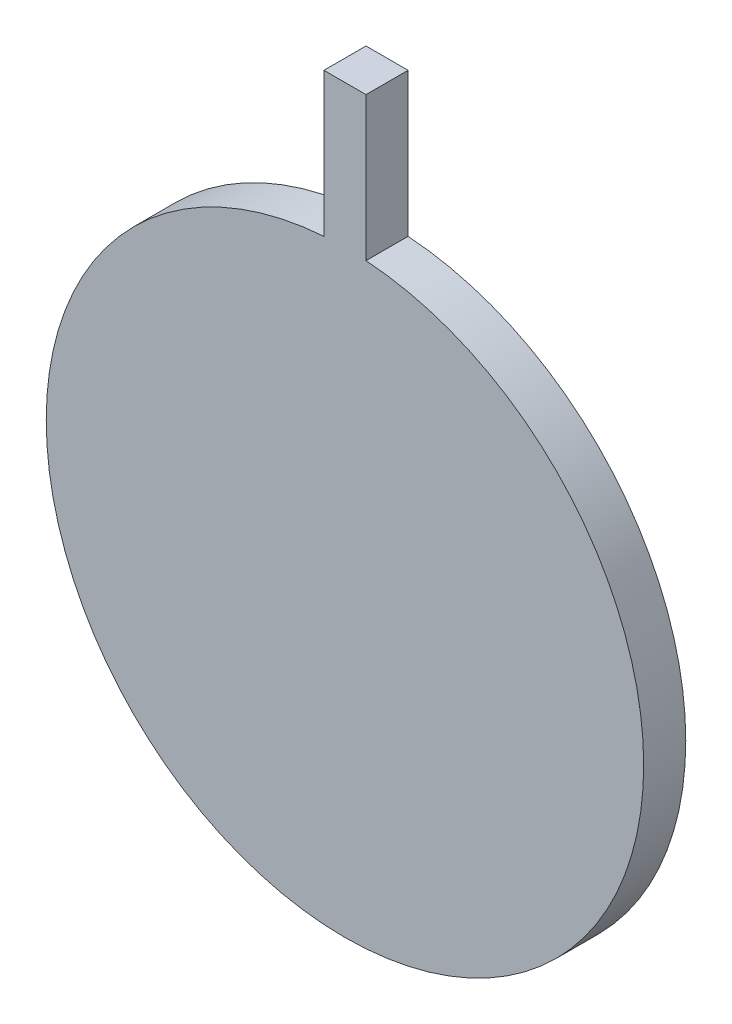
from build123d import *

# Parameters (mm, degrees)
SKETCH1_R           = 18.034
BOSS_EXTRUDE1_DEPTH = 2.54
SKETCH2_W           = 2.54
SKETCH2_H           = 2.54
BOSS_EXTRUDE2_DEPTH = 8.89


with BuildPart() as part:
    # Sketch1 → Boss-Extrude1 (new body)
    with BuildSketch(Plane.XY):
        Circle(SKETCH1_R)
    extrude(amount=BOSS_EXTRUDE1_DEPTH)


with BuildPart() as body_2:
    # Sketch2 → Boss-Extrude2 (new body)
    with BuildSketch(Plane(origin=(0, 17.78, 0), x_dir=(1, 0, 0), z_dir=(0, 1, 0))):
        with Locations((0, -1.27)):
            Rectangle(SKETCH2_W, SKETCH2_H)
    extrude(amount=BOSS_EXTRUDE2_DEPTH)


with BuildPart() as part_1:
    add(part.part)

    # Combine1: union body 2
    add(body_2.part)


solid = part_1.part
